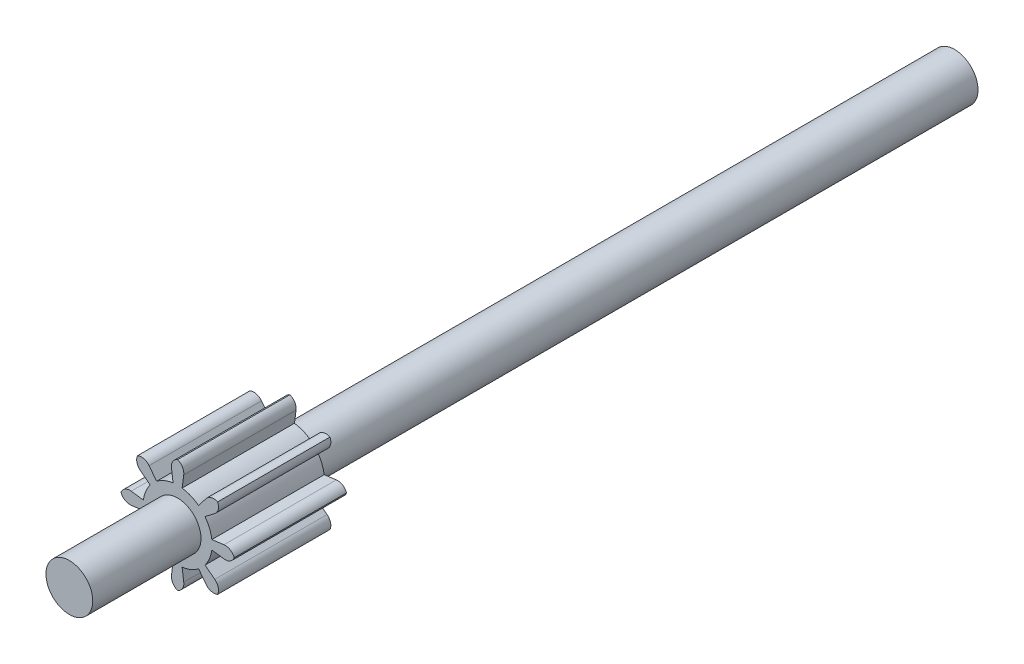
from build123d import *

# Parameters (mm, degrees)
SKETCH1_R                = 0.5
BOSS_EXTRUDE1_DEPTH      = 2.4
BOSS_EXTRUDE3_DEPTH      = 4.7124
BOSS_EXTRUDE3_DEPTH_BACK = 14.2
SKETCH1_3_R              = 0.5


with BuildPart() as part:
    # Sketch1 → Boss-Extrude1 (new body)
    with BuildSketch(Plane.XY):
        with BuildLine():
            Line((-0.096588215, 0.731147705), (-0.130967072, 0.991386719))
            ThreePointArc((-0.130967072, 0.991386719), (-0.103602162, 1.123529505), (0, 1.21))
            ThreePointArc((0, 1.21), (0.103602162, 1.123529505), (0.130967072, 0.991386719))
            Line((0.130967072, 0.991386719), (0.096588215, 0.731147705))
            ThreePointArc((0.096588215, 0.731147705), (0.282229031, 0.681361155), (0.448701318, 0.585297682))
            Line((0.448701318, 0.585297682), (0.608408567, 0.793623976))
            ThreePointArc((0.608408567, 0.793623976), (0.721197541, 0.867713123), (0.855599205, 0.855599205))
            ThreePointArc((0.855599205, 0.855599205), (0.867713123, 0.721197541), (0.793623976, 0.608408567))
            Line((0.793623976, 0.608408567), (0.585297682, 0.448701318))
            ThreePointArc((0.585297682, 0.448701318), (0.681361155, 0.282229031), (0.731147705, 0.096588215))
            Line((0.731147705, 0.096588215), (0.991386719, 0.130967072))
            ThreePointArc((0.991386719, 0.130967072), (1.123529505, 0.103602162), (1.21, 0))
            ThreePointArc((1.21, 0), (1.123529505, -0.103602162), (0.991386719, -0.130967072))
            Line((0.991386719, -0.130967072), (0.731147705, -0.096588215))
            ThreePointArc((0.731147705, -0.096588215), (0.681361155, -0.282229031), (0.585297682, -0.448701318))
            Line((0.585297682, -0.448701318), (0.793623976, -0.608408567))
            ThreePointArc((0.793623976, -0.608408567), (0.867713123, -0.721197541), (0.855599205, -0.855599205))
            ThreePointArc((0.855599205, -0.855599205), (0.721197541, -0.867713123), (0.608408567, -0.793623976))
            Line((0.608408567, -0.793623976), (0.448701318, -0.585297682))
            ThreePointArc((0.448701318, -0.585297682), (0.282229031, -0.681361155), (0.096588215, -0.731147705))
            Line((0.096588215, -0.731147705), (0.130967072, -0.991386719))
            ThreePointArc((0.130967072, -0.991386719), (0.103602162, -1.123529505), (0, -1.21))
            ThreePointArc((0, -1.21), (-0.103602162, -1.123529505), (-0.130967072, -0.991386719))
            Line((-0.130967072, -0.991386719), (-0.096588215, -0.731147705))
            ThreePointArc((-0.096588215, -0.731147705), (-0.282229031, -0.681361155), (-0.448701318, -0.585297682))
            Line((-0.448701318, -0.585297682), (-0.608408567, -0.793623976))
            ThreePointArc((-0.608408567, -0.793623976), (-0.721197541, -0.867713123), (-0.855599205, -0.855599205))
            ThreePointArc((-0.855599205, -0.855599205), (-0.867713123, -0.721197541), (-0.793623976, -0.608408567))
            Line((-0.793623976, -0.608408567), (-0.585297682, -0.448701318))
            ThreePointArc((-0.585297682, -0.448701318), (-0.681361155, -0.282229031), (-0.731147705, -0.096588215))
            Line((-0.731147705, -0.096588215), (-0.991386719, -0.130967072))
            ThreePointArc((-0.991386719, -0.130967072), (-1.123529505, -0.103602162), (-1.21, 0))
            ThreePointArc((-1.21, 0), (-1.123529505, 0.103602162), (-0.991386719, 0.130967072))
            Line((-0.991386719, 0.130967072), (-0.731147705, 0.096588215))
            ThreePointArc((-0.731147705, 0.096588215), (-0.681361155, 0.282229031), (-0.585297682, 0.448701318))
            Line((-0.585297682, 0.448701318), (-0.793623976, 0.608408567))
            ThreePointArc((-0.793623976, 0.608408567), (-0.867713123, 0.721197541), (-0.855599205, 0.855599205))
            ThreePointArc((-0.855599205, 0.855599205), (-0.721197541, 0.867713123), (-0.608408567, 0.793623976))
            Line((-0.608408567, 0.793623976), (-0.448701318, 0.585297682))
            ThreePointArc((-0.448701318, 0.585297682), (-0.282229031, 0.681361155), (-0.096588215, 0.731147705))
        make_face()
        Circle(SKETCH1_R, mode=Mode.SUBTRACT)
    extrude(amount=BOSS_EXTRUDE1_DEPTH)

    # Sketch1<3> → Boss-Extrude3 (add, two sides: drawn at the far end of the back side and taken through both)
    with BuildSketch(Plane.XY.offset(-BOSS_EXTRUDE3_DEPTH_BACK)):
        Circle(SKETCH1_3_R)
    extrude(amount=BOSS_EXTRUDE3_DEPTH + BOSS_EXTRUDE3_DEPTH_BACK)


solid = part.part
